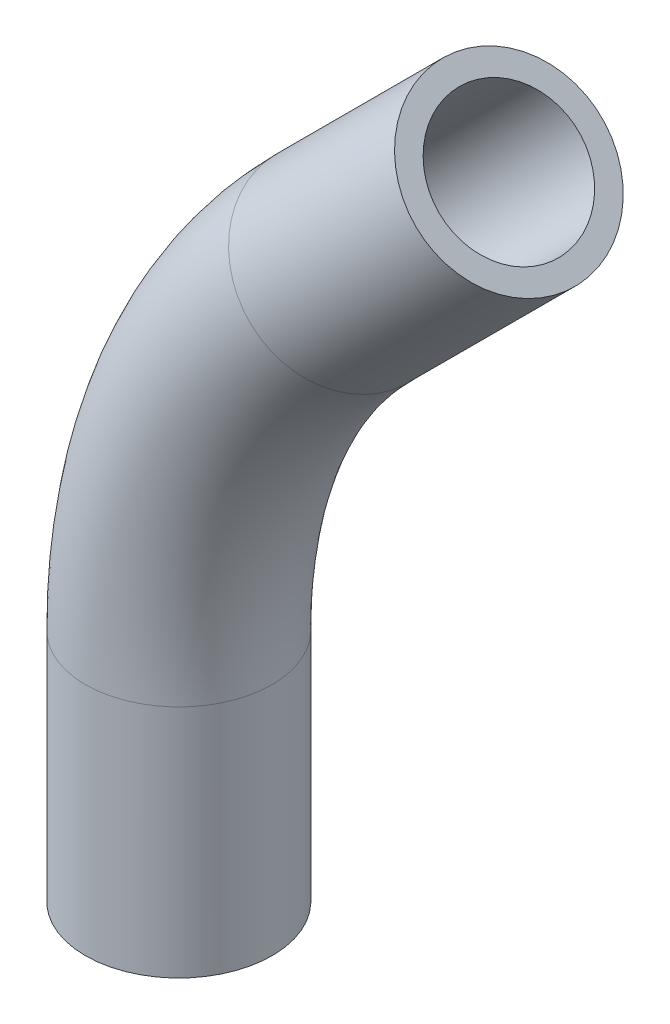
from build123d import *

# Parameters (mm, degrees)
SKETCH2_R   = 4
SKETCH2_R_2 = 3


with BuildPart() as part:
    # Sweep1: sweep along a path in Sketch1
    with BuildLine(Plane.XY) as sweep1_path:
        Line((0, 0), (0, 10.058874503))
        ThreePointArc((0, 10.058874503), (1.82689122, 19.24327688), (7.029437252, 27.029437252))
        Line((7.029437252, 27.029437252), (14.142135624, 34.142135624))
    # Sketch2 → Sweep1 (sweep)
    with BuildSketch(Plane(origin=(0, 0, 0), x_dir=(1, 0, 0), z_dir=(0, 1, 0))):
        Circle(SKETCH2_R)
        Circle(SKETCH2_R_2, mode=Mode.SUBTRACT)
    sweep(path=sweep1_path.line)


solid = part.part
